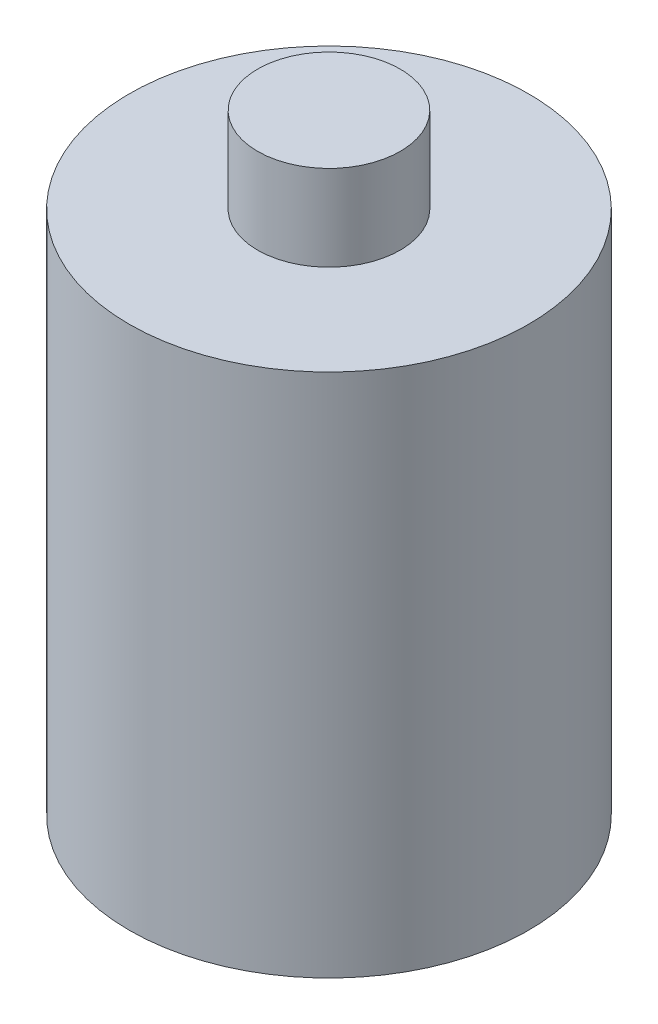
from build123d import *

# Parameters (mm, degrees)
SKETCH_1_R      = 7
EXTRUDE_1_DEPTH = 18.4
SKETCH_2_R      = 2.5
EXTRUDE_2_DEPTH = 3


with BuildPart() as part:
    # 草图1 → 凸台-拉伸1 (new body)
    with BuildSketch(Plane(origin=(0, 0, 0), x_dir=(1, 0, 0), z_dir=(0, 1, 0))):
        with Locations(Location((0, 0, 0), (0, 0, 270))):
            Circle(SKETCH_1_R)
    extrude(amount=EXTRUDE_1_DEPTH)

    # 草图2 → 凸台-拉伸2 (add)
    with BuildSketch(Plane(origin=(0, 18.4, 0), x_dir=(1, 0, 0), z_dir=(0, 1, 0))):
        with Locations(Location((0, 0, 0), (0, 0, 270))):
            Circle(SKETCH_2_R)
    extrude(amount=EXTRUDE_2_DEPTH)


solid = part.part
